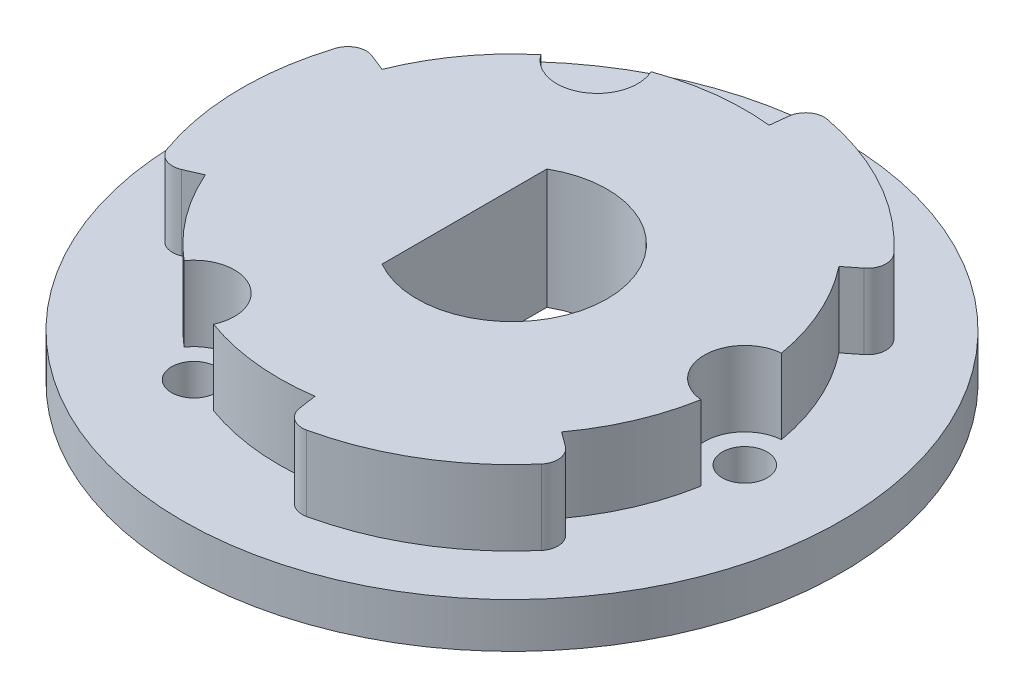
from build123d import *

# Parameters (mm, degrees)
SKETCH1_R           = 19.54
SKETCH1_R_2         = 15.54
BOSS_EXTRUDE1_DEPTH = 7.9
SKETCH1_3_R         = 2.7
BOSS_EXTRUDE2_DEPTH = 7.9
SKETCH1_4_R         = 1.5
CUT_EXTRUDE1_DEPTH  = 29.740793308
CUT_EXTRUDE2_DEPTH  = 29.740793308
SKETCH1_6_R         = 1.5
CUT_EXTRUDE5_DEPTH  = 3
CIRPATTERN1_COUNT   = 3
SKETCH2_R           = 26
SKETCH2_R_2         = 19.54
BOSS_EXTRUDE3_DEPTH = 7.9
CUT_EXTRUDE4_START  = 7.9
SKETCH2_3_R         = 22
SKETCH2_3_R_2       = 19.54
CUT_EXTRUDE4_DEPTH  = 3.14
CUT_EXTRUDE6_START  = 3
SKETCH2_4_R         = 22
CUT_EXTRUDE6_DEPTH  = 3
BOSS_EXTRUDE5_DEPTH = 5
SKETCH5_R           = 22
BOSS_EXTRUDE6_DEPTH = 3
SKETCH6_R           = 1.5
CUT_EXTRUDE7_DEPTH  = 3
CUT_EXTRUDE8_DEPTH  = 15


with BuildPart() as part:
    # Sketch1 → Boss-Extrude1 (new body)
    with BuildSketch(Plane(origin=(0, 0, 0), x_dir=(1, 0, 0), z_dir=(0, 1, 0))):
        with Locations(Location((0, 0, 0), (0, 0, 270))):
            Circle(SKETCH1_R)
        with Locations(Location((0, 0, 0), (0, 0, 270))):
            Circle(SKETCH1_R_2, mode=Mode.SUBTRACT)
    extrude(amount=BOSS_EXTRUDE1_DEPTH)

    # Sketch1<3> → Boss-Extrude2 (add)
    with BuildSketch(Plane(origin=(0, 0, 0), x_dir=(1, 0, 0), z_dir=(0, 1, 0))):
        with Locations((15.54, 0)):
            Circle(SKETCH1_3_R)
    boss_extrude2 = extrude(amount=BOSS_EXTRUDE2_DEPTH)

    # Sketch1<4> → Cut-Extrude1 (cut, symmetric)
    with BuildSketch(Plane(origin=(0, 0, 0), x_dir=(1, 0, 0), z_dir=(0, 1, 0))):
        with Locations(Location((15.54, 0, 0), (0, 0, 270))):
            Circle(SKETCH1_4_R)
    cut_extrude1 = extrude(amount=CUT_EXTRUDE1_DEPTH, both=True, mode=Mode.SUBTRACT)

    # Sketch1<5> → Cut-Extrude2 (cut, symmetric)
    with BuildSketch(Plane(origin=(0, 0, 0), x_dir=(1, 0, 0), z_dir=(0, 1, 0))):
        with BuildLine():
            Line((1.84893352, 16.641004923), (1.716044464, 15.444960065))
            ThreePointArc((1.716044464, 15.444960065), (7.546281877, 13.584742538), (12.206193142, 9.617715372))
            Line((12.206193142, 9.617715372), (13.151430585, 10.362503249))
            ThreePointArc((13.151430585, 10.362503249), (13.623726964, 11.24345363), (13.299320972, 12.188915525))
            ThreePointArc((13.299320972, 12.188915525), (8.760291222, 15.770190161), (3.321432407, 17.731601359))
            ThreePointArc((3.321432407, 17.731601359), (2.347317501, 17.507463762), (1.84893352, 16.641004923))
        make_face()
    cut_extrude2 = extrude(amount=CUT_EXTRUDE2_DEPTH, both=True, mode=Mode.SUBTRACT)

    # Sketch1<6> → Cut-Extrude5 (cut)
    with BuildSketch(Plane(origin=(0, 0, 0), x_dir=(1, 0, 0), z_dir=(0, 1, 0))):
        with BuildLine():
            Line((13.541549805, -7.623518144), (14.590196156, -8.213877046))
            ThreePointArc((14.590196156, -8.213877046), (15.584628409, -8.315079224), (16.335293585, -7.655049543))
            ThreePointArc((16.335293585, -7.655049543), (17.48108114, -4.455715676), (18.006537967, -1.098267026))
            ThreePointArc((18.006537967, -1.098267026), (18.24, 0), (18.006537967, 1.098267026))
            ThreePointArc((18.006537967, 1.098267026), (17.48108114, 4.455715676), (16.335293585, 7.655049543))
            ThreePointArc((16.335293585, 7.655049543), (15.584628409, 8.315079224), (14.590196156, 8.213877046))
            Line((14.590196156, 8.213877046), (13.541549805, 7.623518144))
            ThreePointArc((13.541549805, 7.623518144), (14.632931196, 5.231531765), (15.305444015, 2.689792462))
            ThreePointArc((15.305444015, 2.689792462), (12.84, 0), (15.305444015, -2.689792462))
            ThreePointArc((15.305444015, -2.689792462), (14.632931196, -5.231531765), (13.541549805, -7.623518144))
        make_face()
        with Locations(Location((15.54, 0, 0), (0, 0, 270))):
            Circle(SKETCH1_6_R, mode=Mode.SUBTRACT)
    cut_extrude5 = extrude(amount=CUT_EXTRUDE5_DEPTH, mode=Mode.SUBTRACT)

    # CirPattern1: Boss-Extrude2, Cut-Extrude1, Cut-Extrude2, Cut-Extrude5 ×3 about axis
    cirpattern1_axis = Axis((0, 0, 0), (0, 1, 0))
    add([boss_extrude2.rotate(cirpattern1_axis, i * 360 / CIRPATTERN1_COUNT) for i in range(1, CIRPATTERN1_COUNT)])
    add([cut_extrude1.rotate(cirpattern1_axis, i * 360 / CIRPATTERN1_COUNT) for i in range(1, CIRPATTERN1_COUNT)], mode=Mode.SUBTRACT)
    add([cut_extrude2.rotate(cirpattern1_axis, i * 360 / CIRPATTERN1_COUNT) for i in range(1, CIRPATTERN1_COUNT)], mode=Mode.SUBTRACT)
    add([cut_extrude5.rotate(cirpattern1_axis, i * 360 / CIRPATTERN1_COUNT) for i in range(1, CIRPATTERN1_COUNT)], mode=Mode.SUBTRACT)

    # Sketch2 → Boss-Extrude3 (add)
    with BuildSketch(Plane(origin=(0, 0, 0), x_dir=(1, 0, 0), z_dir=(0, 1, 0))):
        with Locations(Location((0, 0, 0), (0, 0, 270))):
            Circle(SKETCH2_R)
        Circle(SKETCH2_R_2, mode=Mode.SUBTRACT)
    extrude(amount=BOSS_EXTRUDE3_DEPTH)

    # Sketch2<3> → Cut-Extrude4 (cut)
    with BuildSketch(Plane(origin=(0, 0, 0), x_dir=(1, 0, 0), z_dir=(0, 1, 0)).offset(CUT_EXTRUDE4_START)):
        with Locations(Location((0, 0, 0), (0, 0, 270))):
            Circle(SKETCH2_3_R)
        with Locations(Location((0, 0, 0), (0, 0, 270))):
            Circle(SKETCH2_3_R_2, mode=Mode.SUBTRACT)
    extrude(amount=-CUT_EXTRUDE4_DEPTH, mode=Mode.SUBTRACT)

    # Sketch2<4> → Cut-Extrude6 (cut)
    with BuildSketch(Plane(origin=(0, 0, 0), x_dir=(1, 0, 0), z_dir=(0, 1, 0)).offset(CUT_EXTRUDE6_START)):
        with Locations(Location((0, 0, 0), (0, 0, 270))):
            Circle(SKETCH2_4_R)
    extrude(amount=-CUT_EXTRUDE6_DEPTH, mode=Mode.SUBTRACT)


with BuildPart() as body_2:
    # Sketch4 → Boss-Extrude5 (new body)
    with BuildSketch(Plane(origin=(0, -20, 0), x_dir=(-1, 0, 0), z_dir=(0, -1, 0))):
        with BuildLine():
            Line((14.432282409, 5.762015659), (15.549906352, 6.208221358))
            ThreePointArc((15.549906352, 6.208221358), (16.548980018, 6.176766972), (17.205570975, 5.423092055))
            ThreePointArc((17.205570975, 5.423092055), (18.037530912, -0.298460376), (17.016733405, -5.989355912))
            ThreePointArc((17.016733405, -5.989355912), (16.335567089, -6.72089531), (15.335999768, -6.719279063))
            Line((15.335999768, -6.719279063), (14.233750009, -6.236341932))
            ThreePointArc((14.233750009, -6.236341932), (12.435838525, -9.318879771), (9.982150611, -11.910007102))
            ThreePointArc((9.982150611, -11.910007102), (6.42, -11.119766185), (5.323293404, -14.599799565))
            ThreePointArc((5.323293404, -14.599799565), (1.596947601, -15.457728111), (-2.226089267, -15.379731031))
            Line((-2.226089267, -15.379731031), (-2.398475768, -16.570724607))
            ThreePointArc((-2.398475768, -16.570724607), (-2.925252898, -17.420220588), (-3.906250001, -17.612007578))
            ThreePointArc((-3.906250001, -17.612007578), (-9.277239724, -15.471729803), (-13.695301074, -11.742245462))
            ThreePointArc((-13.695301074, -11.742245462), (-13.988249619, -10.786568429), (-13.487066248, -9.92172586))
            Line((-13.487066248, -9.92172586), (-12.517705544, -9.208618132))
            ThreePointArc((-12.517705544, -9.208618132), (-14.288305879, -6.110312195), (-15.305444015, -2.689792462))
            ThreePointArc((-15.305444015, -2.689792462), (-12.84, 0), (-15.305444015, 2.689792462))
            ThreePointArc((-15.305444015, 2.689792462), (-14.18525903, 6.345866865), (-12.206193142, 9.617715372))
            Line((-12.206193142, 9.617715372), (-13.151430585, 10.362503249))
            ThreePointArc((-13.151430585, 10.362503249), (-13.62372712, 11.243453616), (-13.299320974, 12.188915524))
            ThreePointArc((-13.299320974, 12.188915524), (-8.760291188, 15.770190179), (-3.32143233, 17.731601374))
            ThreePointArc((-3.32143233, 17.731601374), (-2.347317469, 17.507463739), (-1.84893352, 16.641004923))
            Line((-1.84893352, 16.641004923), (-1.716044464, 15.444960065))
            ThreePointArc((-1.716044464, 15.444960065), (1.852467354, 15.429191965), (5.323293404, 14.599799565))
            ThreePointArc((5.323293404, 14.599799565), (6.42, 11.119766185), (9.982150611, 11.910007102))
            ThreePointArc((9.982150611, 11.910007102), (12.588311429, 9.111861247), (14.432282409, 5.762015659))
        make_face()
    extrude(amount=BOSS_EXTRUDE5_DEPTH)

    # Sketch5 → Boss-Extrude6 (add)
    with BuildSketch(Plane.XZ.offset(25)):
        with Locations(Location((0, 0, 0), (0, 0, 270))):
            Circle(SKETCH5_R)
    extrude(amount=BOSS_EXTRUDE6_DEPTH)

    # Sketch6 → Cut-Extrude7 (cut)
    with BuildSketch(Plane(origin=(0, -25, 0), x_dir=(1, 0, 0), z_dir=(0, 1, 0))):
        with Locations(Location((-7.77, 13.458034775, 0), (0, 0, 270))):
            Circle(SKETCH6_R)
        with Locations(Location((15.54, 0, 0), (0, 0, 270))):
            Circle(SKETCH6_R)
        with Locations(Location((-7.77, -13.458034775, 0), (0, 0, 270))):
            Circle(SKETCH6_R)
    extrude(amount=-CUT_EXTRUDE7_DEPTH, mode=Mode.SUBTRACT)

    # Sketch7 → Cut-Extrude8 (cut)
    with BuildSketch(Plane.XZ.offset(28)):
        with BuildLine():
            ThreePointArc((6.35, 0), (3.175, 5.499261314), (-3.175, 5.499261314))
            Line((-3.175, 5.499261314), (-3.175, -5.499261314))
            ThreePointArc((-3.175, -5.499261314), (3.175, -5.499261314), (6.35, 0))
        make_face()
    extrude(amount=-CUT_EXTRUDE8_DEPTH, mode=Mode.SUBTRACT)


solid = body_2.part
